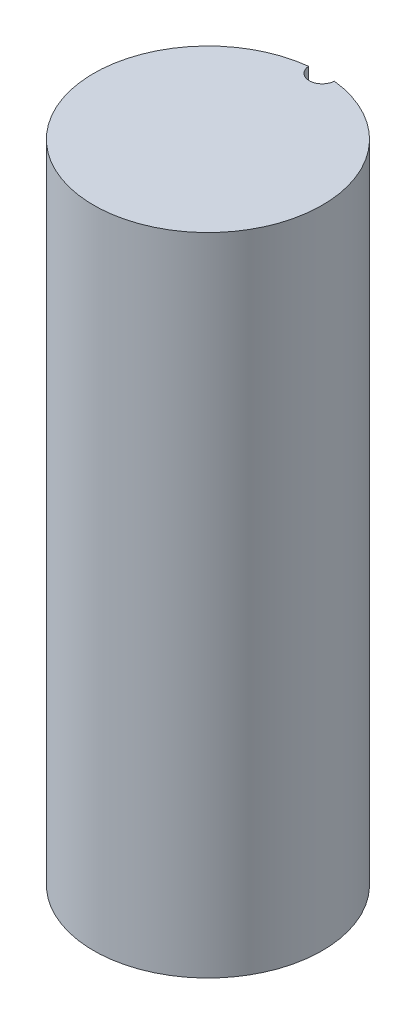
from build123d import *

# Parameters (mm, degrees)
SKETCH1_R           = 8.9916
BOSS_EXTRUDE1_DEPTH = 50.8
SKETCH2_R           = 1.016
CUT_EXTRUDE1_DEPTH  = 53.367334676


with BuildPart() as part:
    # Sketch1 → Boss-Extrude1 (new body)
    with BuildSketch(Plane(origin=(0, 0, 0), x_dir=(1, 0, 0), z_dir=(0, 1, 0))):
        with Locations(Location((0, 0, 0), (0, 0, 270))):
            Circle(SKETCH1_R)
    extrude(amount=BOSS_EXTRUDE1_DEPTH)

    # Sketch2 → Cut-Extrude1 (cut, through all)
    with BuildSketch(Plane(origin=(0, 50.8, 0), x_dir=(1, 0, 0), z_dir=(0, 1, 0))):
        with Locations((0, 8.9916)):
            Circle(SKETCH2_R)
    extrude(amount=-CUT_EXTRUDE1_DEPTH, mode=Mode.SUBTRACT)


solid = part.part
